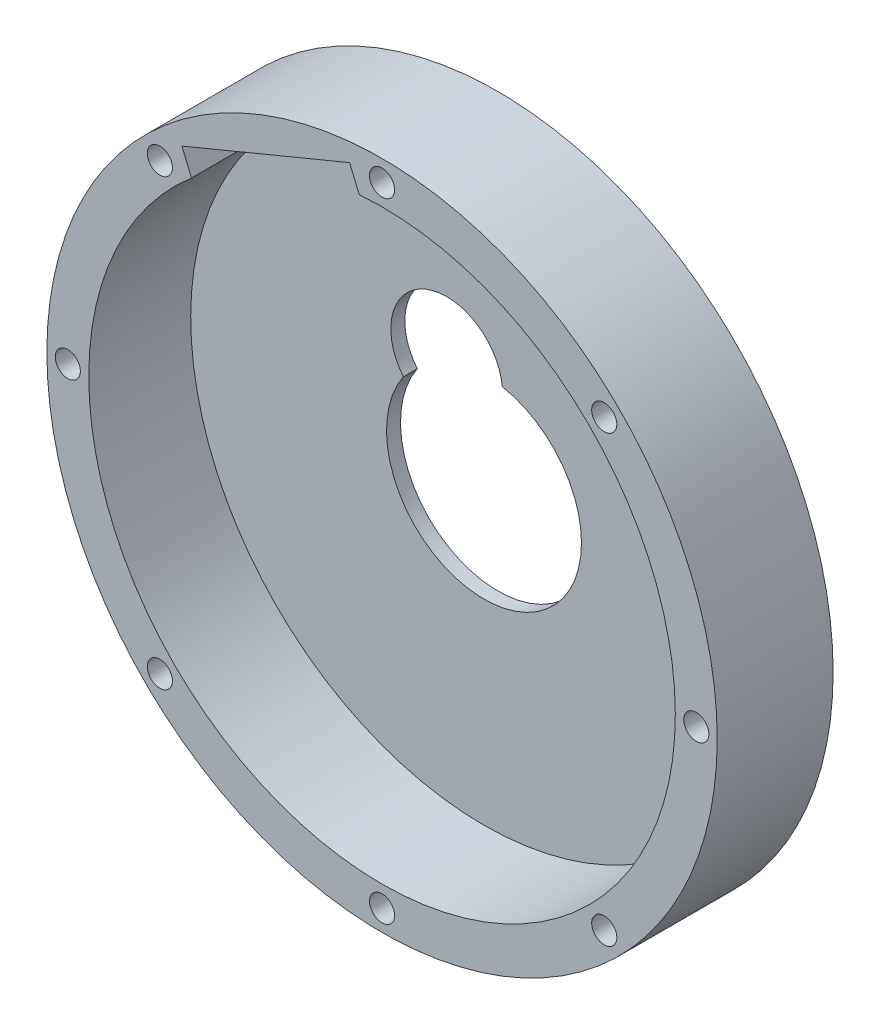
from build123d import *

# Parameters (mm, degrees)
ESQUISSE1_R             = 24
ESQUISSE1_R_2           = 21
ESQUISSE1_R_3           = 0.9
BOSS_EXTRU_1_DEPTH      = 8.3
ESQUISSE2_R             = 21
BOSS_EXTRU_2_DEPTH      = 1
ENL_V_MAT_EXTRU_1_DEPTH = 35.941236383
ENL_V_MAT_EXTRU_2_DEPTH = 35.71728676


with BuildPart() as part:
    # Esquisse1 → Boss.-Extru.1 (new body)
    with BuildSketch(Plane.XY):
        with Locations(Location((0, 0, 0), (0, 0, 180))):
            Circle(ESQUISSE1_R)
        with Locations(Location((0, 0, 0), (0, 0, 180))):
            Circle(ESQUISSE1_R_2, mode=Mode.SUBTRACT)
        with Locations(Location((22.5, 0, 0), (0, 0, 180))):
            Circle(ESQUISSE1_R_3, mode=Mode.SUBTRACT)
        with Locations(Location((15.909902577, -15.909902577, 0), (0, 0, 180))):
            Circle(ESQUISSE1_R_3, mode=Mode.SUBTRACT)
        with Locations(Location((0, -22.5, 0), (0, 0, 180))):
            Circle(ESQUISSE1_R_3, mode=Mode.SUBTRACT)
        with Locations(Location((-15.909902577, -15.909902577, 0), (0, 0, 180))):
            Circle(ESQUISSE1_R_3, mode=Mode.SUBTRACT)
        with Locations(Location((-22.5, 0, 0), (0, 0, 180))):
            Circle(ESQUISSE1_R_3, mode=Mode.SUBTRACT)
        with Locations(Location((-15.909902577, 15.909902577, 0), (0, 0, 180))):
            Circle(ESQUISSE1_R_3, mode=Mode.SUBTRACT)
        with Locations(Location((0, 22.5, 0), (0, 0, 180))):
            Circle(ESQUISSE1_R_3, mode=Mode.SUBTRACT)
        with Locations(Location((15.909902577, 15.909902577, 0), (0, 0, 180))):
            Circle(ESQUISSE1_R_3, mode=Mode.SUBTRACT)
    extrude(amount=BOSS_EXTRU_1_DEPTH)

    # Esquisse2 → Boss.-Extru.2 (add)
    with BuildSketch(Plane.XY):
        with Locations(Location((0, 0, 0), (0, 0, 180))):
            Circle(ESQUISSE2_R)
    extrude(amount=BOSS_EXTRU_2_DEPTH)

    # Esquisse5 → Enlèv. mat.-Extru.1 (cut, through all)
    with BuildSketch(Plane(origin=(0, 0, 0), x_dir=(-1, 0, 0), z_dir=(0, 0, -1))):
        with BuildLine():
            ThreePointArc((-1.30820243, 6.85590272), (-2.670976724, -6.448308231), (5.772894113, 3.922816495))
            ThreePointArc((5.772894113, 3.922816495), (4.201710453, 10.143826361), (-1.30820243, 6.85590272))
        make_face()
    extrude(amount=-ENL_V_MAT_EXTRU_1_DEPTH, mode=Mode.SUBTRACT)

    # Esquisse6 → Enlèv. mat.-Extru.2 (cut, through all)
    with BuildSketch(Plane.XY.offset(1)):
        Polygon((-2.317366162, 22.579935361), (-14.327800085, 17.60505074), (-11.237259755, 10.143826361), (0.773174168, 15.118710982), align=None)
    extrude(amount=ENL_V_MAT_EXTRU_2_DEPTH, mode=Mode.SUBTRACT)


solid = part.part
